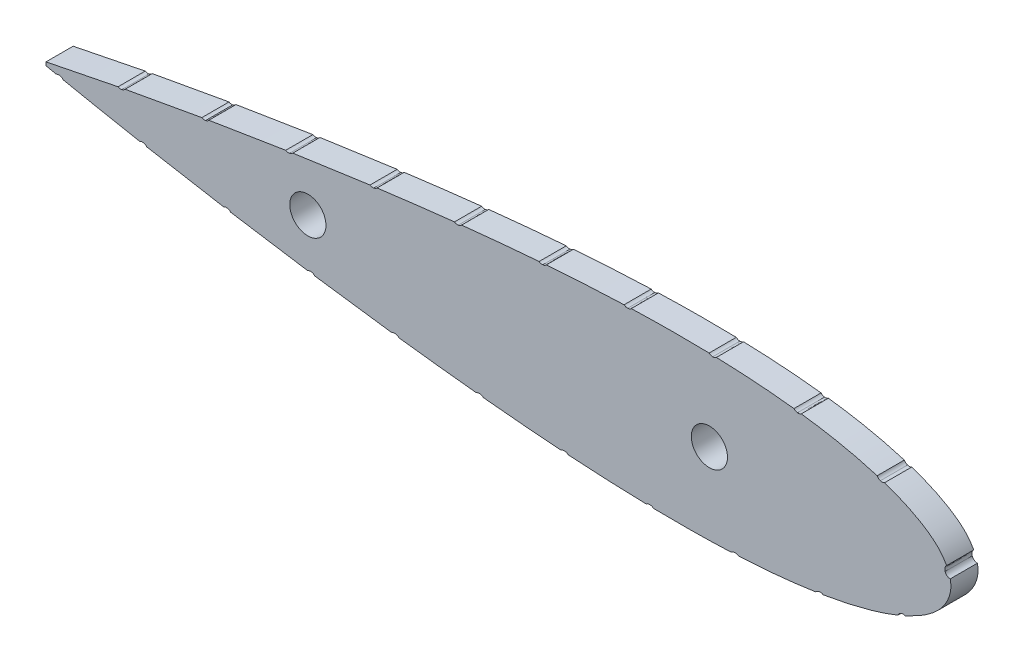
from build123d import *

# Parameters (mm, degrees)
SKETCH1_R           = 2
BOSS_EXTRUDE1_DEPTH = 3
CUT_EXTRUDE1_DEPTH  = 10


with BuildPart() as part:
    # Sketch1 → Boss-Extrude1 (new body)
    with BuildSketch(Plane.XY):
        with BuildLine():
            Line((-220, -0.189), (-220, 0.189))
            add(Edge.make_bspline(
                [(-220, 0.189), (-218.33414458, 0.533383089), (-215.006179921, 1.221374816), (-208.344137236, 2.497831843), (-200.016287914, 3.965674155), (-190.014996408, 5.528168834), (-180.015249764, 6.884288854), (-170.015366318, 7.993417238), (-160.01307518, 8.779505199), (-151.668027673, 9.058728645), (-144.995966244, 8.947287883), (-139.987869065, 8.65073069), (-134.970356471, 8.078172202), (-130.794306968, 7.278076968), (-127.463530799, 6.326486377), (-124.919965675, 5.365093589), (-122.789457128, 4.207381685), (-120.829702633, 2.6061248), (-119.458572693, 0), (-120.829702633, -2.6061248), (-122.789457128, -4.207381685), (-124.919965675, -5.365093589), (-127.463530799, -6.326486377), (-130.794306968, -7.278076968), (-134.970356471, -8.078172202), (-139.987869065, -8.65073069), (-144.995966244, -8.947287883), (-151.668027673, -9.058728645), (-160.01307518, -8.779505199), (-170.015366318, -7.993417238), (-180.015249764, -6.884288854), (-190.014996408, -5.528168834), (-200.016287914, -3.965674155), (-208.344137236, -2.497831843), (-215.006179921, -1.221374816), (-218.33414458, -0.533383089), (-220, -0.189)],
                knots=[0, 0, 0, 0, 0.024603844, 0.049152359, 0.098108667, 0.146905312, 0.195554797, 0.244056277, 0.292409554, 0.340643731, 0.364754111, 0.3889056, 0.413178108, 0.437756239, 0.450304697, 0.463229879, 0.477067953, 0.485035559, 0.5, 0.514964441, 0.522932047, 0.536770121, 0.549695303, 0.562243761, 0.586821892, 0.6110944, 0.635245889, 0.659356269, 0.707590446, 0.755943723, 0.804445203, 0.853094688, 0.901891333, 0.950847641, 0.975396156, 1, 1, 1, 1], degree=3))
        make_face()
        with Locations((-191.062269847, 0)):
            Circle(SKETCH1_R, mode=Mode.SUBTRACT)
        with Locations((-146.687624955, 0)):
            Circle(SKETCH1_R, mode=Mode.SUBTRACT)
    extrude(amount=BOSS_EXTRUDE1_DEPTH)

    # Sketch2 → Cut-Extrude1 (cut)
    with BuildSketch(Plane.XY.offset(3)):
        with BuildLine():
            add(Edge.make_bspline(
                [(-218.697260254, -1.58380119), (-218.656315579, -1.590402434), (-218.576324974, -1.6032988), (-218.454980449, -1.590868554), (-218.338725142, -1.556304977), (-218.230200928, -1.497736774), (-218.133774359, -1.421261847), (-218.057451032, -1.326247784), (-217.997789537, -1.218858789), (-217.977930951, -1.138896852), (-217.967804667, -1.09812269)],
                knots=[0, 0, 0, 0, 1.017083743, 1.987001844, 2.972391076, 3.986042786, 5.004656253, 5.979834707, 6.969878046, 8, 8, 8, 8], degree=3))
            add(Edge.make_bspline(
                [(-217.967804667, -1.09812269), (-217.961337513, -1.057199017), (-217.94863495, -0.976818136), (-217.959324197, -0.855106092), (-217.996291515, -0.73924141), (-218.052895983, -0.629563747), (-218.129452171, -0.532963052), (-218.22070025, -0.452745498), (-218.32790462, -0.394958778), (-218.406432616, -0.374196016), (-218.446459125, -0.363613027)],
                knots=[0, 0, 0, 0, 1.019051807, 2.001586779, 2.979565923, 4.002845271, 5.029175072, 6.001582509, 6.981386527, 8, 8, 8, 8], degree=3))
            add(Edge.make_bspline(
                [(-218.446459125, -0.363613027), (-218.487411383, -0.356887905), (-218.56765309, -0.343710726), (-218.688754566, -0.357984213), (-218.80492213, -0.393329346), (-218.913117999, -0.452823907), (-219.009497267, -0.530568581), (-219.089848208, -0.622802143), (-219.146132381, -0.73174314), (-219.167147706, -0.810105634), (-219.177864726, -0.850067543)],
                knots=[0, 0, 0, 0, 1.017323363, 1.993339767, 2.969660132, 3.993090107, 5.011943554, 6.005958459, 6.983114227, 8, 8, 8, 8], degree=3))
            add(Edge.make_bspline(
                [(-219.177864726, -0.850067543), (-219.183964972, -0.891654787), (-219.195923832, -0.973182005), (-219.186109849, -1.096221565), (-219.150587, -1.213223754), (-219.092376546, -1.321989046), (-219.015412951, -1.417289018), (-218.923484728, -1.496210608), (-218.815600919, -1.552089863), (-218.737227655, -1.573091268), (-218.697260254, -1.58380119)],
                knots=[0, 0, 0, 0, 1.03204317, 2.023207143, 3.008371278, 4.021791435, 5.040172216, 6.006883534, 6.98358598, 8, 8, 8, 8], degree=3))
        make_face()
        with BuildLine():
            add(Edge.make_bspline(
                [(-209.454093155, -3.39072638), (-209.41313478, -3.395905473), (-209.333006792, -3.406037476), (-209.212560341, -3.393248724), (-209.097831618, -3.355930044), (-208.991258447, -3.295520816), (-208.897566743, -3.215851043), (-208.820296862, -3.121799846), (-208.7649076, -3.012136874), (-208.746213474, -2.932576519), (-208.736640585, -2.891835246)],
                knots=[0, 0, 0, 0, 1.017350342, 1.990270291, 2.963727447, 3.97931436, 4.996664702, 5.986102446, 6.968723191, 8, 8, 8, 8], degree=3))
            add(Edge.make_bspline(
                [(-208.736640585, -2.891835246), (-208.730790174, -2.851049542), (-208.719231735, -2.770470753), (-208.73403217, -2.649978783), (-208.769488191, -2.534114214), (-208.829482751, -2.426964705), (-208.907776575, -2.331925336), (-209.001490511, -2.25542917), (-209.108649328, -2.198238516), (-209.187500397, -2.180199792), (-209.227863467, -2.170965951)],
                knots=[0, 0, 0, 0, 1.01599218, 2.007257742, 2.974947525, 4.0003418, 5.02558983, 6.005291499, 6.978928747, 8, 8, 8, 8], degree=3))
            add(Edge.make_bspline(
                [(-209.227863467, -2.170965951), (-209.268656235, -2.16504312), (-209.348812326, -2.153405006), (-209.469066352, -2.169053363), (-209.584766779, -2.205334439), (-209.690517096, -2.268263921), (-209.786456743, -2.345350895), (-209.861167893, -2.441044636), (-209.918809079, -2.548193156), (-209.936943613, -2.627559504), (-209.946170218, -2.667940021)],
                knots=[0, 0, 0, 0, 1.015131532, 1.994691214, 2.969194873, 3.99532649, 5.019706031, 5.994823937, 6.979793698, 8, 8, 8, 8], degree=3))
            add(Edge.make_bspline(
                [(-209.946170218, -2.667940021), (-209.951489579, -2.709342465), (-209.961894325, -2.790326238), (-209.950127083, -2.912599346), (-209.911322496, -3.028361127), (-209.852360779, -3.136309582), (-209.773405721, -3.22992222), (-209.680823097, -3.306828617), (-209.572411165, -3.361226637), (-209.494156264, -3.38073761), (-209.454093155, -3.39072638)],
                knots=[0, 0, 0, 0, 1.029108418, 2.012950774, 3.00360181, 4.02703375, 5.033689393, 6.011516172, 6.981982694, 8, 8, 8, 8], degree=3))
        make_face()
        with BuildLine():
            add(Edge.make_bspline(
                [(-200.1631017, -5.027933636), (-200.121852608, -5.032979576), (-200.040921765, -5.042879726), (-199.920224074, -5.025066035), (-199.805586625, -4.985742665), (-199.698705287, -4.924084928), (-199.605961744, -4.842589253), (-199.53002031, -4.746425881), (-199.477870402, -4.634538003), (-199.459601411, -4.553965723), (-199.450263468, -4.512782313)],
                knots=[0, 0, 0, 0, 1.016013028, 1.993420662, 2.962496889, 3.977929338, 5.000523251, 5.975816916, 6.965366724, 8, 8, 8, 8], degree=3))
            add(Edge.make_bspline(
                [(-199.450263468, -4.512782313), (-199.446049586, -4.471392354), (-199.437771318, -4.390080815), (-199.451875453, -4.267959066), (-199.492751786, -4.15252007), (-199.554944136, -4.045751122), (-199.63371733, -3.950708637), (-199.730367514, -3.876406225), (-199.839527463, -3.822056939), (-199.918943294, -3.804624354), (-199.959279891, -3.795770059)],
                knots=[0, 0, 0, 0, 1.020846881, 2.005477475, 2.993257936, 4.010403059, 5.030380147, 6.007318786, 6.987884685, 8, 8, 8, 8], degree=3))
            add(Edge.make_bspline(
                [(-199.959279891, -3.795770059), (-200.000515693, -3.79086695), (-200.081202544, -3.781272946), (-200.202564063, -3.797032611), (-200.317952732, -3.836782051), (-200.423737192, -3.901585791), (-200.517006403, -3.982363166), (-200.592475202, -4.078344404), (-200.644551636, -4.189132766), (-200.662474291, -4.268791204), (-200.671637421, -4.309517351)],
                knots=[0, 0, 0, 0, 1.017437535, 1.990838647, 2.978338469, 3.996502279, 5.020529926, 5.997191007, 6.976044541, 8, 8, 8, 8], degree=3))
            add(Edge.make_bspline(
                [(-200.671637421, -4.309517351), (-200.676768399, -4.351225738), (-200.686887652, -4.43348253), (-200.670401689, -4.556033478), (-200.631971027, -4.67296524), (-200.568183903, -4.778932537), (-200.488258926, -4.872933813), (-200.392450585, -4.947037307), (-200.283341828, -5.001514503), (-200.20392234, -5.018964534), (-200.1631017, -5.027933636)],
                knots=[0, 0, 0, 0, 1.026868821, 2.025178646, 3.003008525, 4.026719509, 5.037918843, 6.01235648, 6.978375654, 8, 8, 8, 8], degree=3))
        make_face()
        with BuildLine():
            add(Edge.make_bspline(
                [(-190.857676115, -6.4842893), (-190.81647415, -6.487999182), (-190.736159309, -6.49523084), (-190.616051205, -6.478709934), (-190.502851517, -6.436434376), (-190.397362304, -6.372959911), (-190.306035119, -6.289731724), (-190.233575997, -6.191576021), (-190.181619043, -6.079887541), (-190.165847649, -5.999098591), (-190.157753082, -5.957634178)],
                knots=[0, 0, 0, 0, 1.016544963, 1.981547422, 2.95626941, 3.974200754, 4.995989429, 5.978674654, 6.962567667, 8, 8, 8, 8], degree=3))
            add(Edge.make_bspline(
                [(-190.157753082, -5.957634178), (-190.154095664, -5.916430144), (-190.146926374, -5.835661784), (-190.162967886, -5.714733992), (-190.20418351, -5.60011524), (-190.268666637, -5.495021754), (-190.349614594, -5.401882221), (-190.446631905, -5.328348106), (-190.557209981, -5.277323164), (-190.636251582, -5.26076887), (-190.676581488, -5.252322265)],
                knots=[0, 0, 0, 0, 1.018597505, 1.996660093, 2.983144274, 4.003130959, 5.022898425, 6.011721769, 6.985507986, 8, 8, 8, 8], degree=3))
            add(Edge.make_bspline(
                [(-190.676581488, -5.252322265), (-190.717805872, -5.2485246), (-190.798820201, -5.241061412), (-190.91926672, -5.259153408), (-191.03378109, -5.300383355), (-191.137165808, -5.367664575), (-191.230891663, -5.448520489), (-191.302074967, -5.547482415), (-191.3564303, -5.6569353), (-191.3715769, -5.737034587), (-191.379346046, -5.778119921)],
                knots=[0, 0, 0, 0, 1.016415999, 1.997464924, 2.972063253, 3.990885665, 5.018844379, 6.001404936, 6.974860488, 8, 8, 8, 8], degree=3))
            add(Edge.make_bspline(
                [(-191.379346046, -5.778119921), (-191.383531041, -5.820275781), (-191.39166348, -5.902194624), (-191.37347207, -6.024477341), (-191.33072004, -6.138890377), (-191.266943375, -6.244444958), (-191.185237207, -6.335983485), (-191.087705243, -6.407763493), (-190.978288152, -6.461382744), (-190.898246958, -6.476584113), (-190.857676115, -6.4842893)],
                knots=[0, 0, 0, 0, 1.038609022, 2.0182639, 3.008511575, 4.024867508, 5.034649745, 6.004359402, 6.988460601, 8, 8, 8, 8], degree=3))
        make_face()
        with BuildLine():
            add(Edge.make_bspline(
                [(-181.522284908, -7.760086813), (-181.481253745, -7.763109228), (-181.400808511, -7.769034941), (-181.281236894, -7.749797404), (-181.170036965, -7.703649881), (-181.066573435, -7.63932411), (-180.975263105, -7.556525888), (-180.907266458, -7.455746244), (-180.856138551, -7.344101042), (-180.841998974, -7.263333876), (-180.834715508, -7.22172974)],
                knots=[0, 0, 0, 0, 1.01473174, 1.989471543, 2.960522047, 3.972597417, 4.990272548, 5.98076505, 6.959867839, 8, 8, 8, 8], degree=3))
            add(Edge.make_bspline(
                [(-180.834715508, -7.22172974), (-180.831257504, -7.180155682), (-180.824499664, -7.098909146), (-180.847672888, -6.979052489), (-180.888503913, -6.864747943), (-180.956014885, -6.761660391), (-181.039071728, -6.671010657), (-181.136285326, -6.598899865), (-181.247083775, -6.549143504), (-181.326318517, -6.53522008), (-181.366908004, -6.528087544)],
                knots=[0, 0, 0, 0, 1.026745248, 2.006527595, 2.990423172, 4.011471134, 5.029217693, 6.017133677, 6.984239433, 8, 8, 8, 8], degree=3))
            add(Edge.make_bspline(
                [(-181.366908004, -6.528087544), (-181.407959523, -6.52498049), (-181.489097218, -6.518839447), (-181.609024831, -6.539634391), (-181.721943318, -6.585284003), (-181.824816157, -6.652965561), (-181.915539362, -6.736287554), (-181.985179123, -6.83591455), (-182.034983626, -6.946712195), (-182.049127023, -7.026918035), (-182.056285116, -7.067510888)],
                knots=[0, 0, 0, 0, 1.013588785, 2.003342613, 2.973299363, 4.002084792, 5.028910282, 5.99539945, 6.985454756, 8, 8, 8, 8], degree=3))
            add(Edge.make_bspline(
                [(-182.056285116, -7.067510888), (-182.059622662, -7.109501504), (-182.066128504, -7.191353373), (-182.046969707, -7.312702344), (-182.001933685, -7.425779694), (-181.935434736, -7.5288665), (-181.853098684, -7.620238832), (-181.753089056, -7.688606828), (-181.642688738, -7.739038126), (-181.562907275, -7.752985315), (-181.522284908, -7.760086813)],
                knots=[0, 0, 0, 0, 1.036292566, 2.020034298, 2.998768905, 4.017456004, 5.032849332, 6.0096806, 6.986588072, 8, 8, 8, 8], degree=3))
        make_face()
        with BuildLine():
            add(Edge.make_bspline(
                [(-172.157549354, -8.830223401), (-172.116590222, -8.83239739), (-172.036287009, -8.836659648), (-171.918641876, -8.810819903), (-171.80702286, -8.766776726), (-171.706212051, -8.697820989), (-171.619134731, -8.612004989), (-171.550098509, -8.511767146), (-171.503211046, -8.398276712), (-171.490998075, -8.317137475), (-171.484795161, -8.275927218)],
                knots=[0, 0, 0, 0, 1.012308337, 1.984700588, 2.95724742, 3.971632593, 4.988386099, 5.972075339, 6.970026087, 8, 8, 8, 8], degree=3))
            add(Edge.make_bspline(
                [(-171.484795161, -8.275927218), (-171.482584276, -8.234514412), (-171.478250243, -8.153332239), (-171.502862798, -8.034028721), (-171.549818974, -7.922438062), (-171.617533751, -7.819987454), (-171.70263586, -7.731784425), (-171.801639586, -7.663029674), (-171.913063086, -7.616170784), (-171.992793754, -7.604312555), (-172.033536919, -7.598252882)],
                knots=[0, 0, 0, 0, 1.024593132, 2.008526036, 2.988169627, 4.011440798, 5.035299718, 6.007932833, 6.982033842, 8, 8, 8, 8], degree=3))
            add(Edge.make_bspline(
                [(-172.033536919, -7.598252882), (-172.074925602, -7.596143953), (-172.155413054, -7.592042775), (-172.274705342, -7.614900516), (-172.385461345, -7.663429254), (-172.486586902, -7.733051829), (-172.573915183, -7.819115694), (-172.643121241, -7.918671718), (-172.687756833, -8.031897164), (-172.700043393, -8.111878524), (-172.706291111, -8.152549065)],
                knots=[0, 0, 0, 0, 1.023907344, 1.991164857, 2.977108749, 3.999841887, 5.016166536, 5.999440866, 6.982715195, 8, 8, 8, 8], degree=3))
            add(Edge.make_bspline(
                [(-172.706291111, -8.152549065), (-172.708530795, -8.194430805), (-172.712886206, -8.275876323), (-172.689941819, -8.396121839), (-172.64405487, -8.50819474), (-172.575208581, -8.609770597), (-172.489462261, -8.696305281), (-172.390576594, -8.765548663), (-172.278442951, -8.812092506), (-172.198271514, -8.824116136), (-172.157549354, -8.830223401)],
                knots=[0, 0, 0, 0, 1.034811226, 2.012350397, 3.000411703, 4.013265455, 5.028483964, 5.999408191, 6.98382238, 8, 8, 8, 8], degree=3))
        make_face()
        with BuildLine():
            add(Edge.make_bspline(
                [(-162.74339823, -9.638940642), (-162.702147052, -9.640011209), (-162.620942812, -9.642118654), (-162.503317074, -9.611627451), (-162.391668029, -9.564201702), (-162.293561758, -9.489646231), (-162.207394958, -9.401262042), (-162.1430533, -9.297101263), (-162.100591355, -9.181433322), (-162.090754969, -9.099762911), (-162.085711765, -9.057889758)],
                knots=[0, 0, 0, 0, 1.010205218, 1.988620704, 2.961116924, 3.976511524, 4.996343518, 5.982220741, 6.965466448, 8, 8, 8, 8], degree=3))
            add(Edge.make_bspline(
                [(-162.085711765, -9.057889758), (-162.084940846, -9.016725227), (-162.08341786, -8.935402799), (-162.109730734, -8.816406143), (-162.161950778, -8.70672191), (-162.232922438, -8.606331554), (-162.320934387, -8.519480816), (-162.424409899, -8.45545291), (-162.537438126, -8.410968816), (-162.617862034, -8.401578856), (-162.658807365, -8.396798249)],
                knots=[0, 0, 0, 0, 1.014489628, 2.004170991, 2.976962093, 3.997102291, 5.028450758, 6.007362029, 6.985510372, 8, 8, 8, 8], degree=3))
            add(Edge.make_bspline(
                [(-162.658807365, -8.396798249), (-162.699989135, -8.39595431), (-162.780880549, -8.3942966), (-162.899856746, -8.421544156), (-163.009824715, -8.473753648), (-163.109133892, -8.54717329), (-163.194193677, -8.63623241), (-163.261320915, -8.738263736), (-163.302620208, -8.853263172), (-163.312536553, -8.933862553), (-163.31756178, -8.974707258)],
                knots=[0, 0, 0, 0, 1.012949068, 1.98968824, 2.977866715, 3.99601926, 5.018621251, 6.001134601, 6.987050932, 8, 8, 8, 8], degree=3))
            add(Edge.make_bspline(
                [(-163.31756178, -8.974707258), (-163.318630357, -9.016887732), (-163.320717148, -9.099260653), (-163.29303308, -9.219607648), (-163.24364418, -9.331618331), (-163.169221632, -9.430519492), (-163.081149615, -9.515743454), (-162.978615326, -9.580842767), (-162.865157239, -9.624504434), (-162.784313006, -9.634089631), (-162.74339823, -9.638940642)],
                knots=[0, 0, 0, 0, 1.03372899, 2.018736836, 3.007491397, 4.02237714, 5.041698052, 6.00491788, 6.990301039, 8, 8, 8, 8], degree=3))
        make_face()
        with BuildLine():
            add(Edge.make_bspline(
                [(-153.300987328, -10.062931805), (-153.259582584, -10.061308345), (-153.178705049, -10.058137175), (-153.061248247, -10.026967368), (-152.955029871, -9.969692454), (-152.858668398, -9.894887845), (-152.77877158, -9.801798561), (-152.72005014, -9.695638411), (-152.682198876, -9.578517701), (-152.676241249, -9.49637469), (-152.673182863, -9.45420605)],
                knots=[0, 0, 0, 0, 1.02085579, 1.994078245, 2.967989923, 3.981221809, 4.990102983, 5.973082298, 6.95946883, 8, 8, 8, 8], degree=3))
            add(Edge.make_bspline(
                [(-152.673182863, -9.45420605), (-152.67477994, -9.412786288), (-152.677899574, -9.331879419), (-152.709554654, -9.214216735), (-152.765740098, -9.106860307), (-152.842096367, -9.010446428), (-152.93324838, -8.928019071), (-153.038335243, -8.867189305), (-153.153911415, -8.8298414), (-153.23455752, -8.82380666), (-153.275722583, -8.820726282)],
                knots=[0, 0, 0, 0, 1.022854299, 1.997982012, 2.984404427, 3.999619897, 5.025761833, 6.005331366, 6.981839737, 8, 8, 8, 8], degree=3))
            add(Edge.make_bspline(
                [(-153.275722583, -8.820726282), (-153.317114428, -8.822377441), (-153.397966767, -8.825602714), (-153.515850829, -8.856445255), (-153.621841306, -8.915584032), (-153.718253309, -8.992197498), (-153.798868865, -9.085318095), (-153.858620397, -9.191238291), (-153.895766255, -9.307118145), (-153.901898162, -9.388229385), (-153.905009716, -9.429388196)],
                knots=[0, 0, 0, 0, 1.021360064, 1.995063264, 2.975640288, 3.997365632, 5.023900495, 5.996453334, 6.983327114, 8, 8, 8, 8], degree=3))
            add(Edge.make_bspline(
                [(-153.905009716, -9.429388196), (-153.903356474, -9.47127772), (-153.900108315, -9.553578967), (-153.869463279, -9.673016917), (-153.812589614, -9.781548646), (-153.735633193, -9.8772406), (-153.642985392, -9.957216982), (-153.538039973, -10.016272099), (-153.422829324, -10.053886825), (-153.342162809, -10.05987513), (-153.300987328, -10.062931805)],
                knots=[0, 0, 0, 0, 1.032082427, 2.027754513, 3.011393867, 4.031727098, 5.039731339, 6.010959063, 6.984712343, 8, 8, 8, 8], degree=3))
        make_face()
        with BuildLine():
            add(Edge.make_bspline(
                [(-143.82322469, -9.956485438), (-143.782172976, -9.952449137), (-143.701340696, -9.944501517), (-143.58711677, -9.902275263), (-143.483561803, -9.839581631), (-143.393504327, -9.756340826), (-143.319508356, -9.658338397), (-143.267567352, -9.547911013), (-143.236359079, -9.428685098), (-143.236995884, -9.346101472), (-143.237320261, -9.304034885)],
                knots=[0, 0, 0, 0, 1.012445362, 1.993540801, 2.968945603, 3.977792258, 4.995721205, 5.973633967, 6.967806246, 8, 8, 8, 8], degree=3))
            add(Edge.make_bspline(
                [(-143.237320261, -9.304034885), (-143.24152005, -9.263043742), (-143.249777325, -9.182450368), (-143.289570525, -9.067461824), (-143.353300168, -8.9641374), (-143.435923692, -8.872590844), (-143.534041015, -8.798037703), (-143.642569465, -8.742921083), (-143.760777898, -8.714510777), (-143.841633582, -8.714493538), (-143.882658987, -8.71448479)],
                knots=[0, 0, 0, 0, 1.016100133, 1.997771509, 2.976697371, 3.9989593, 5.02879904, 6.006119793, 6.988324127, 8, 8, 8, 8], degree=3))
            add(Edge.make_bspline(
                [(-143.882658987, -8.71448479), (-143.923639469, -8.718707857), (-144.00421188, -8.7270109), (-144.119562582, -8.76654174), (-144.222373571, -8.831683758), (-144.311816662, -8.9160451), (-144.386372523, -9.014045244), (-144.437484689, -9.12376983), (-144.469929233, -9.241162847), (-144.46920871, -9.32237622), (-144.468839601, -9.363980139)],
                knots=[0, 0, 0, 0, 1.015645235, 1.996877125, 2.980769731, 4.00023209, 5.021378242, 6.002381735, 6.976661761, 8, 8, 8, 8], degree=3))
            add(Edge.make_bspline(
                [(-144.468839601, -9.363980139), (-144.464565518, -9.405953087), (-144.456210295, -9.488004213), (-144.416516024, -9.604590247), (-144.352434523, -9.708348647), (-144.270243054, -9.799157319), (-144.172936385, -9.874361061), (-144.063406335, -9.925081643), (-143.946049549, -9.957587975), (-143.864831173, -9.956858919), (-143.82322469, -9.956485438)],
                knots=[0, 0, 0, 0, 1.036926318, 2.027043013, 3.002580043, 4.021303119, 5.030360116, 6.008405446, 6.979747583, 8, 8, 8, 8], degree=3))
        make_face()
        with BuildLine():
            add(Edge.make_bspline(
                [(-134.344897434, -9.015032627), (-134.304541357, -9.006401491), (-134.225473684, -8.989490929), (-134.116455546, -8.935452679), (-134.02024229, -8.861898052), (-133.940014819, -8.768397447), (-133.879056176, -8.66178487), (-133.836759323, -8.54701134), (-133.823105795, -8.424449787), (-133.831178008, -8.342558446), (-133.835292105, -8.300821582)],
                knots=[0, 0, 0, 0, 1.012785711, 1.984301159, 2.96667441, 3.977700793, 4.995308973, 5.977077965, 6.968994516, 8, 8, 8, 8], degree=3))
            add(Edge.make_bspline(
                [(-133.835292105, -8.300821582), (-133.844224237, -8.260072975), (-133.861608901, -8.180763719), (-133.913362749, -8.070131019), (-133.98809648, -7.974583322), (-134.079770072, -7.892421982), (-134.185371695, -7.828634522), (-134.29997031, -7.788392321), (-134.420607614, -7.769933941), (-134.501250397, -7.779403821), (-134.542404508, -7.784236547)],
                knots=[0, 0, 0, 0, 1.026970072, 1.998797982, 2.983113067, 4.000392807, 5.021034499, 6.004744131, 6.981769018, 8, 8, 8, 8], degree=3))
            add(Edge.make_bspline(
                [(-134.542404508, -7.784236547), (-134.583248165, -7.792991182), (-134.662806368, -7.810044085), (-134.772154426, -7.86434528), (-134.86909325, -7.937660891), (-134.947638405, -8.033308682), (-135.010909095, -8.1392105), (-135.052485519, -8.25424583), (-135.067127232, -8.375651713), (-135.059286403, -8.456666497), (-135.05529082, -8.497950563)],
                knots=[0, 0, 0, 0, 1.024336744, 1.995276506, 2.977067637, 3.993854241, 5.019925436, 6.001112666, 6.981393349, 8, 8, 8, 8], degree=3))
            add(Edge.make_bspline(
                [(-135.05529082, -8.497950563), (-135.04619882, -8.539167333), (-135.028497931, -8.619410784), (-134.97658948, -8.731030652), (-134.901640128, -8.827434423), (-134.808870672, -8.908367938), (-134.702882152, -8.970814196), (-134.588626786, -9.012247272), (-134.467189849, -9.026863827), (-134.386179328, -9.019026451), (-134.344897434, -9.015032627)],
                knots=[0, 0, 0, 0, 1.03525736, 2.015505443, 2.996130472, 4.01577697, 5.023464958, 6.003486804, 6.982603178, 8, 8, 8, 8], degree=3))
        make_face()
        with BuildLine():
            add(Edge.make_bspline(
                [(-125.036806645, -6.496534824), (-124.999674074, -6.478810809), (-124.926512373, -6.44388947), (-124.834430737, -6.364965393), (-124.758423393, -6.270552057), (-124.703630259, -6.160539777), (-124.667396436, -6.042721914), (-124.656979648, -5.920754603), (-124.67161612, -5.798421471), (-124.700469271, -5.721096406), (-124.715129872, -5.681806695)],
                knots=[0, 0, 0, 0, 1.009307495, 1.988622192, 2.955817418, 3.97674459, 4.995635143, 5.973509504, 6.970318039, 8, 8, 8, 8], degree=3))
            add(Edge.make_bspline(
                [(-124.715129872, -5.681806695), (-124.733220964, -5.644339038), (-124.768451003, -5.571375667), (-124.847309607, -5.478633391), (-124.941834651, -5.403086384), (-125.051498229, -5.346007005), (-125.169341169, -5.309572183), (-125.290399198, -5.298031755), (-125.411547311, -5.310057148), (-125.487853471, -5.338325731), (-125.526790266, -5.352750359)],
                knots=[0, 0, 0, 0, 1.023302985, 1.992748982, 2.974342655, 3.99407058, 5.026148727, 5.99858839, 6.978738374, 8, 8, 8, 8], degree=3))
            add(Edge.make_bspline(
                [(-125.526790266, -5.352750359), (-125.564234994, -5.370863055), (-125.637598223, -5.406350183), (-125.730607875, -5.485097218), (-125.805053925, -5.581089179), (-125.859140484, -5.691942842), (-125.893436006, -5.811009681), (-125.90572902, -5.932229857), (-125.891705472, -6.053552683), (-125.863799541, -6.129589732), (-125.849504893, -6.168539258)],
                knots=[0, 0, 0, 0, 1.021645264, 2.001648785, 2.970828259, 3.99617528, 5.021522301, 6.009528449, 6.980392787, 8, 8, 8, 8], degree=3))
            add(Edge.make_bspline(
                [(-125.849504893, -6.168539258), (-125.830924331, -6.206251503), (-125.794480346, -6.280220443), (-125.716246883, -6.375396379), (-125.620641817, -6.451741601), (-125.510812952, -6.507148292), (-125.393311426, -6.541399322), (-125.273033573, -6.554163943), (-125.152201885, -6.538490541), (-125.075771388, -6.510701732), (-125.036806645, -6.496534824)],
                knots=[0, 0, 0, 0, 1.032249434, 2.02465795, 3.003678304, 4.024298625, 5.032126422, 6.002016762, 6.981415686, 8, 8, 8, 8], degree=3))
        make_face()
        with BuildLine():
            add(Edge.make_bspline(
                [(-119.469869042, 1.483092257), (-119.485036072, 1.521468607), (-119.514615119, 1.596310935), (-119.584155237, 1.69555665), (-119.672798439, 1.777052806), (-119.776886783, 1.841232707), (-119.891102066, 1.883849458), (-120.01021116, 1.907733969), (-120.132839969, 1.901351368), (-120.211892151, 1.879650969), (-120.252111389, 1.868610496)],
                knots=[0, 0, 0, 0, 1.018920366, 1.987118975, 2.969695084, 3.981747491, 4.994318462, 5.973836912, 6.969152617, 8, 8, 8, 8], degree=3))
            add(Edge.make_bspline(
                [(-120.252111389, 1.868610496), (-120.290478047, 1.853432149), (-120.365762291, 1.823648726), (-120.46547766, 1.7538272), (-120.547124188, 1.664298261), (-120.6131049, 1.561169785), (-120.659637779, 1.447536805), (-120.67838019, 1.328305161), (-120.676345907, 1.207239688), (-120.653858669, 1.129732786), (-120.642391894, 1.090210185)],
                knots=[0, 0, 0, 0, 1.02064517, 2.002741578, 2.986980967, 4.007847287, 5.026130532, 6.006693373, 6.983565827, 8, 8, 8, 8], degree=3))
            add(Edge.make_bspline(
                [(-120.642391894, 1.090210185), (-120.62722575, 1.051830672), (-120.597648432, 0.976982176), (-120.528095785, 0.877781171), (-120.439500836, 0.796112815), (-120.334866003, 0.732378101), (-120.220925125, 0.687239571), (-120.101113645, 0.667683292), (-119.979657431, 0.671264296), (-119.901753969, 0.693632592), (-119.86222822, 0.704981557)],
                knots=[0, 0, 0, 0, 1.021016783, 1.991207449, 2.975805197, 3.98993989, 5.015004983, 5.995924843, 6.983195747, 8, 8, 8, 8], degree=3))
            add(Edge.make_bspline(
                [(-119.86222822, 0.704981557), (-119.823104407, 0.719936954), (-119.746408802, 0.749254477), (-119.646111402, 0.820192727), (-119.563685439, 0.909328204), (-119.500208735, 1.013446631), (-119.455633621, 1.126620465), (-119.432620595, 1.244599178), (-119.438144985, 1.365582697), (-119.459113427, 1.44325222), (-119.469869042, 1.483092257)],
                knots=[0, 0, 0, 0, 1.03439643, 2.027758887, 3.011015355, 4.023768531, 5.030572158, 6.010768851, 6.979637863, 8, 8, 8, 8], degree=3))
        make_face()
        with BuildLine():
            add(Edge.make_bspline(
                [(-127.412668991, 7.381218584), (-127.452376848, 7.391892544), (-127.529972224, 7.412751134), (-127.650722112, 7.414911754), (-127.768937682, 7.393652067), (-127.881181026, 7.346228567), (-127.983785995, 7.28151329), (-128.071605179, 7.198276287), (-128.140010815, 7.097055275), (-128.169150443, 7.020475416), (-128.183995106, 6.981463175)],
                knots=[0, 0, 0, 0, 1.018022228, 1.989375033, 2.971469884, 3.980854552, 4.996204022, 5.969885283, 6.965794323, 8, 8, 8, 8], degree=3))
            add(Edge.make_bspline(
                [(-128.183995106, 6.981463175), (-128.194680118, 6.94176039), (-128.215739793, 6.863507999), (-128.217502763, 6.741948142), (-128.195322932, 6.622859948), (-128.151005489, 6.508734013), (-128.086975519, 6.404536933), (-128.003754928, 6.318010445), (-127.905238244, 6.248332699), (-127.82973471, 6.220280437), (-127.79101177, 6.20589348)],
                knots=[0, 0, 0, 0, 1.018303366, 2.007029841, 2.989395908, 4.012139572, 5.032295411, 6.006245564, 6.977477893, 8, 8, 8, 8], degree=3))
            add(Edge.make_bspline(
                [(-127.79101177, 6.20589348), (-127.751314841, 6.195121122), (-127.673466067, 6.173995687), (-127.552598928, 6.173340595), (-127.434244965, 6.196274993), (-127.320766027, 6.24276906), (-127.217624034, 6.309027337), (-127.130202761, 6.392292652), (-127.060266229, 6.491320162), (-127.032013202, 6.567262963), (-127.017612027, 6.605972643)],
                knots=[0, 0, 0, 0, 1.017720609, 1.995829429, 2.969222208, 3.995211102, 5.021714553, 5.995107332, 6.978063065, 8, 8, 8, 8], degree=3))
            add(Edge.make_bspline(
                [(-127.017612027, 6.605972643), (-127.007204274, 6.646374218), (-126.986747508, 6.725784791), (-126.98282431, 6.84804593), (-127.006847532, 6.966734411), (-127.051722793, 7.079760859), (-127.117145957, 7.182512199), (-127.20022494, 7.269450859), (-127.29876265, 7.339275182), (-127.374358488, 7.367111619), (-127.412668991, 7.381218584)],
                knots=[0, 0, 0, 0, 1.03357593, 2.031526132, 3.0046145, 4.019865641, 5.034596846, 6.007685214, 6.990333545, 8, 8, 8, 8], degree=3))
        make_face()
        with BuildLine():
            add(Edge.make_bspline(
                [(-136.804062994, 9.360797669), (-136.845103895, 9.363747187), (-136.925568221, 9.369529979), (-137.045045855, 9.349969711), (-137.156706718, 9.303817557), (-137.259463761, 9.237651452), (-137.350632371, 9.155052348), (-137.418846164, 9.054940421), (-137.469360908, 8.943498713), (-137.483372695, 8.862721616), (-137.490590335, 8.821112364)],
                knots=[0, 0, 0, 0, 1.015057213, 1.990109661, 2.961471627, 3.982775405, 5.000776953, 5.980117386, 6.959534219, 8, 8, 8, 8], degree=3))
            add(Edge.make_bspline(
                [(-137.490590335, 8.821112364), (-137.493478983, 8.780078793), (-137.499174354, 8.699175428), (-137.480193889, 8.578742022), (-137.434288565, 8.465790352), (-137.369232334, 8.361199881), (-137.285225933, 8.271361693), (-137.188627803, 8.198500104), (-137.077313602, 8.149575128), (-136.997630261, 8.135610631), (-136.957057855, 8.128500321)],
                knots=[0, 0, 0, 0, 1.014737758, 2.000696011, 2.981635858, 4.011006495, 5.028687661, 6.005196104, 6.984304699, 8, 8, 8, 8], degree=3))
            add(Edge.make_bspline(
                [(-136.957057855, 8.128500321), (-136.915980156, 8.125368892), (-136.835242342, 8.119214099), (-136.715694073, 8.141555051), (-136.602856835, 8.185956362), (-136.499349496, 8.25286286), (-136.408760716, 8.336603503), (-136.3397436, 8.437205276), (-136.289748896, 8.548387291), (-136.275789722, 8.628639214), (-136.268724867, 8.669255389)],
                knots=[0, 0, 0, 0, 1.01343626, 1.991899069, 2.971580767, 3.991253616, 5.017924588, 5.995701104, 6.985607425, 8, 8, 8, 8], degree=3))
            add(Edge.make_bspline(
                [(-136.268724867, 8.669255389), (-136.265274493, 8.711292837), (-136.258532378, 8.793435027), (-136.280709183, 8.91408869), (-136.323343233, 9.02785872), (-136.390625818, 9.130322614), (-136.472938774, 9.221603298), (-136.573131753, 9.289760401), (-136.683615914, 9.339982735), (-136.763426035, 9.353775036), (-136.804062994, 9.360797669)],
                knots=[0, 0, 0, 0, 1.036576694, 2.025495963, 2.997397683, 4.016364082, 5.032035808, 6.0091349, 6.986310218, 8, 8, 8, 8], degree=3))
        make_face()
        with BuildLine():
            add(Edge.make_bspline(
                [(-146.286467738, 10.046736269), (-146.327923899, 10.045795896), (-146.409054013, 10.043955579), (-146.526821243, 10.012207685), (-146.633747546, 9.955488572), (-146.729875239, 9.879392377), (-146.810599265, 9.786728746), (-146.870974975, 9.681108907), (-146.910770645, 9.564552866), (-146.916595838, 9.482383916), (-146.919585135, 9.440217521)],
                knots=[0, 0, 0, 0, 1.018615324, 1.993440191, 2.971382072, 3.981214804, 4.997495525, 5.978317501, 6.962539218, 8, 8, 8, 8], degree=3))
            add(Edge.make_bspline(
                [(-146.919585135, 9.440217521), (-146.918641099, 9.398763118), (-146.916793611, 9.317636446), (-146.885097779, 9.199844227), (-146.828004183, 9.092683485), (-146.752417378, 8.996013361), (-146.661582776, 8.912632965), (-146.555879655, 8.853306593), (-146.44108395, 8.813186457), (-146.360352441, 8.807414883), (-146.31915982, 8.804469983)],
                knots=[0, 0, 0, 0, 1.022319469, 2.000689238, 2.982187357, 4.00487245, 5.022794195, 6.007182883, 6.983180658, 8, 8, 8, 8], degree=3))
            add(Edge.make_bspline(
                [(-146.31915982, 8.804469983), (-146.277674157, 8.805320171), (-146.19695739, 8.806974343), (-146.07963043, 8.839814562), (-145.972057564, 8.895167416), (-145.875909747, 8.971956138), (-145.794709878, 9.064035615), (-145.736481041, 9.170628695), (-145.696533198, 9.285724495), (-145.690666543, 9.366922126), (-145.687690753, 9.408108644)],
                knots=[0, 0, 0, 0, 1.02255038, 1.989529737, 2.98178438, 3.99551824, 5.015724998, 5.994927084, 6.982950989, 8, 8, 8, 8], degree=3))
            add(Edge.make_bspline(
                [(-145.687690753, 9.408108644), (-145.688656954, 9.450045673), (-145.690558692, 9.532588812), (-145.721561588, 9.65171958), (-145.777390626, 9.76033161), (-145.852740456, 9.856709055), (-145.944548562, 9.938448006), (-146.049686792, 9.997971799), (-146.164559575, 10.038000944), (-146.245280512, 10.043784999), (-146.286467738, 10.046736269)],
                knots=[0, 0, 0, 0, 1.031673327, 2.030605342, 3.003284778, 4.023213567, 5.030818252, 6.012553851, 6.985921152, 8, 8, 8, 8], degree=3))
        make_face()
        with BuildLine():
            add(Edge.make_bspline(
                [(-155.75664322, 9.996649292), (-155.797742286, 9.993057218), (-155.878163279, 9.986028394), (-155.993168384, 9.946986562), (-156.097504283, 9.885826749), (-156.187483075, 9.802582193), (-156.265267997, 9.70736321), (-156.317163311, 9.596705051), (-156.350415597, 9.478215202), (-156.350829942, 9.39581733), (-156.351041264, 9.353793245)],
                knots=[0, 0, 0, 0, 1.014251473, 1.984646377, 2.966549096, 3.974325305, 4.993406225, 5.976823058, 6.968151053, 8, 8, 8, 8], degree=3))
            add(Edge.make_bspline(
                [(-156.351041264, 9.353793245), (-156.347389594, 9.312717225), (-156.340201631, 9.231863), (-156.301692302, 9.116099174), (-156.239607996, 9.011405088), (-156.15741902, 8.919815914), (-156.061274627, 8.843149664), (-155.953506577, 8.788156247), (-155.836025346, 8.757508886), (-155.755317095, 8.755555305), (-155.713805564, 8.754550499)],
                knots=[0, 0, 0, 0, 1.016863676, 2.001599074, 2.986030681, 4.006051529, 5.027757091, 6.009298003, 6.97610115, 8, 8, 8, 8], degree=3))
            add(Edge.make_bspline(
                [(-155.713805564, 8.754550499), (-155.67270966, 8.758144784), (-155.592294851, 8.765177937), (-155.477244724, 8.804188261), (-155.37247905, 8.865823702), (-155.281418188, 8.949278132), (-155.206419091, 9.04694694), (-155.153192047, 9.155761342), (-155.120085279, 9.272989804), (-155.119569734, 9.354404881), (-155.11930681, 9.395925925)],
                knots=[0, 0, 0, 0, 1.016294537, 1.988644163, 2.972524783, 3.999493594, 5.021650853, 5.996455524, 6.978208175, 8, 8, 8, 8], degree=3))
            add(Edge.make_bspline(
                [(-155.11930681, 9.395925925), (-155.122915825, 9.438023737), (-155.129937877, 9.519933369), (-155.169195087, 9.636121571), (-155.229132837, 9.741860889), (-155.311874946, 9.832661823), (-155.407526128, 9.910614335), (-155.51738509, 9.961803587), (-155.634065652, 9.996180033), (-155.715084528, 9.996490194), (-155.75664322, 9.996649292)],
                knots=[0, 0, 0, 0, 1.037929242, 2.019496917, 2.995371215, 4.012110832, 5.030529745, 6.013307738, 6.980924725, 8, 8, 8, 8], degree=3))
        make_face()
        with BuildLine():
            add(Edge.make_bspline(
                [(-165.195229933, 9.461022139), (-165.236124995, 9.455977188), (-165.31683241, 9.446020853), (-165.429959802, 9.401385816), (-165.533059291, 9.336808428), (-165.619608849, 9.249335587), (-165.691407621, 9.149067337), (-165.742133003, 9.037738221), (-165.766366193, 8.916629847), (-165.764173959, 8.834284996), (-165.763050366, 8.792080526)],
                knots=[0, 0, 0, 0, 1.009295571, 1.991869749, 2.961035781, 3.980171259, 4.994872374, 5.979701028, 6.964529682, 8, 8, 8, 8], degree=3))
            add(Edge.make_bspline(
                [(-165.763050366, 8.792080526), (-165.757959702, 8.75121714), (-165.747913152, 8.670572237), (-165.703864568, 8.556797884), (-165.636549021, 8.455197023), (-165.551371874, 8.365926147), (-165.451710691, 8.292875174), (-165.340125957, 8.244636602), (-165.222032734, 8.215179956), (-165.140606321, 8.217683199), (-165.099294929, 8.218953209)],
                knots=[0, 0, 0, 0, 1.012724528, 1.998636881, 2.976057674, 4.001562717, 5.028228327, 5.999538271, 6.985073097, 8, 8, 8, 8], degree=3))
            add(Edge.make_bspline(
                [(-165.099294929, 8.218953209), (-165.058362276, 8.223878064), (-164.977474023, 8.233610218), (-164.86461121, 8.280139813), (-164.762330866, 8.346305783), (-164.674927519, 8.433601749), (-164.603801749, 8.53476294), (-164.55554171, 8.646657641), (-164.52812426, 8.765429822), (-164.530345193, 8.846614115), (-164.531474497, 8.887894823)],
                knots=[0, 0, 0, 0, 1.011985069, 1.999814267, 2.97652138, 3.998372577, 5.024578273, 6.005461476, 6.985814164, 8, 8, 8, 8], degree=3))
            add(Edge.make_bspline(
                [(-164.531474497, 8.887894823), (-164.53669708, 8.929734771), (-164.546944441, 9.011829989), (-164.591028098, 9.127176605), (-164.658302811, 9.228915292), (-164.743589477, 9.317304686), (-164.843994603, 9.387906269), (-164.953824463, 9.439504076), (-165.07311309, 9.463736789), (-165.15400725, 9.461938517), (-165.195229933, 9.461022139)],
                knots=[0, 0, 0, 0, 1.035097089, 2.03099015, 3.006500686, 4.020029379, 5.036187962, 6.01223034, 6.987056655, 8, 8, 8, 8], degree=3))
        make_face()
        with BuildLine():
            add(Edge.make_bspline(
                [(-174.582092086, 8.57488649), (-174.622683091, 8.568139933), (-174.702026621, 8.554952389), (-174.813770273, 8.509066913), (-174.911149534, 8.438418588), (-174.995724625, 8.350435783), (-175.064506596, 8.248867782), (-175.10948157, 8.136287956), (-175.132424584, 8.016208254), (-175.127933488, 7.934473199), (-175.125626788, 7.892492733)],
                knots=[0, 0, 0, 0, 1.017268995, 1.988463059, 2.960430058, 3.976738913, 4.999456156, 5.97842883, 6.961687878, 8, 8, 8, 8], degree=3))
            add(Edge.make_bspline(
                [(-175.125626788, 7.892492733), (-175.11885402, 7.851908739), (-175.105534916, 7.77209758), (-175.059503561, 7.65941058), (-174.98857999, 7.560579634), (-174.900809866, 7.475023376), (-174.799560103, 7.405211973), (-174.687996411, 7.359148764), (-174.569192124, 7.335516556), (-174.488989384, 7.34069807), (-174.4480815, 7.343340932)],
                knots=[0, 0, 0, 0, 1.017992469, 2.001950804, 2.985909139, 4.013167641, 5.028126731, 6.014756485, 6.98741474, 8, 8, 8, 8], degree=3))
            add(Edge.make_bspline(
                [(-174.4480815, 7.343340932), (-174.407497419, 7.350112153), (-174.327686088, 7.363428217), (-174.21500034, 7.409481792), (-174.116502072, 7.480078428), (-174.03094501, 7.568039789), (-173.965113708, 7.671523022), (-173.919487017, 7.783602549), (-173.896435187, 7.903239486), (-173.901806681, 7.984355588), (-173.904546798, 8.025734688)],
                knots=[0, 0, 0, 0, 1.016152564, 1.998332507, 2.98051245, 3.995705927, 5.017154053, 5.995052325, 6.977232268, 8, 8, 8, 8], degree=3))
            add(Edge.make_bspline(
                [(-173.904546798, 8.025734688), (-173.910590702, 8.067041859), (-173.922489352, 8.148363403), (-173.972180198, 8.260128733), (-174.038227865, 8.361806507), (-174.127150166, 8.4458268), (-174.229490362, 8.512650958), (-174.34038395, 8.560046032), (-174.460088051, 8.580839739), (-174.540628635, 8.57690972), (-174.582092086, 8.57488649)],
                knots=[0, 0, 0, 0, 1.028323473, 2.024463382, 2.997172165, 4.012080714, 5.024625228, 6.009195351, 6.975105133, 8, 8, 8, 8], degree=3))
        make_face()
        with BuildLine():
            add(Edge.make_bspline(
                [(-183.94828177, 7.448756438), (-183.988820577, 7.44123133), (-184.06843793, 7.426452177), (-184.178043602, 7.37531965), (-184.276500781, 7.305521642), (-184.357251882, 7.213904529), (-184.423641048, 7.110924784), (-184.469170092, 6.997925979), (-184.486317946, 6.875888674), (-184.48022533, 6.793964132), (-184.477095879, 6.751883876)],
                knots=[0, 0, 0, 0, 1.014662429, 1.992775358, 2.959376161, 3.976022436, 4.98766492, 5.974815305, 6.959770926, 8, 8, 8, 8], degree=3))
            add(Edge.make_bspline(
                [(-184.477095879, 6.751883876), (-184.469546096, 6.711352075), (-184.454628773, 6.631266861), (-184.403269793, 6.520742245), (-184.333174414, 6.420790116), (-184.241077799, 6.338850261), (-184.138879131, 6.270716029), (-184.025925295, 6.227157625), (-183.906490613, 6.206522542), (-183.825835923, 6.213618982), (-183.784800516, 6.217229502)],
                knots=[0, 0, 0, 0, 1.015552805, 2.00659135, 2.985486217, 4.013331463, 5.034902629, 6.005822659, 6.985404604, 8, 8, 8, 8], degree=3))
            add(Edge.make_bspline(
                [(-183.784800516, 6.217229502), (-183.744352012, 6.224937531), (-183.664988124, 6.240061431), (-183.553567605, 6.288786358), (-183.455753162, 6.361286164), (-183.372648297, 6.452343668), (-183.306763887, 6.556387561), (-183.265369468, 6.670554987), (-183.244956148, 6.790522419), (-183.252024835, 6.871631724), (-183.255601228, 6.91266888)],
                knots=[0, 0, 0, 0, 1.015101615, 1.991727823, 2.97452924, 4.001917835, 5.022303415, 5.995558766, 6.985855368, 8, 8, 8, 8], degree=3))
            add(Edge.make_bspline(
                [(-183.255601228, 6.91266888), (-183.262751813, 6.954323234), (-183.2767131, 7.035652024), (-183.3287858, 7.147120894), (-183.39863435, 7.246179028), (-183.489121064, 7.329149946), (-183.593507921, 7.393631112), (-183.706065772, 7.439469269), (-183.826613464, 7.457132314), (-183.90715007, 7.451588022), (-183.94828177, 7.448756438)],
                knots=[0, 0, 0, 0, 1.037617373, 2.025914634, 3.002101807, 4.01028392, 5.028299325, 6.013583018, 6.985496012, 8, 8, 8, 8], degree=3))
        make_face()
        with BuildLine():
            add(Edge.make_bspline(
                [(-193.284528834, 6.120127636), (-193.324947066, 6.111915819), (-193.404136517, 6.095826812), (-193.514002244, 6.043868041), (-193.608959991, 5.969059632), (-193.689841172, 5.877390815), (-193.754029479, 5.772363061), (-193.795261118, 5.657678448), (-193.81250131, 5.535299744), (-193.803644563, 5.453446496), (-193.799086835, 5.411324391)],
                knots=[0, 0, 0, 0, 1.013783302, 1.986255689, 2.962313592, 3.974335833, 4.984814628, 5.977258975, 6.959087027, 8, 8, 8, 8], degree=3))
            add(Edge.make_bspline(
                [(-193.799086835, 5.411324391), (-193.790795573, 5.370391795), (-193.774645258, 5.290660352), (-193.721748888, 5.18055633), (-193.648936079, 5.083161859), (-193.556323835, 5.001638681), (-193.452168245, 4.935620997), (-193.337513105, 4.896213088), (-193.217601531, 4.875893224), (-193.136826221, 4.884500683), (-193.095604479, 4.888893293)],
                knots=[0, 0, 0, 0, 1.026913519, 2.000295733, 2.984556614, 4.007983644, 5.02856913, 6.004854006, 6.98182509, 8, 8, 8, 8], degree=3))
            add(Edge.make_bspline(
                [(-193.095604479, 4.888893293), (-193.055099608, 4.896947654), (-192.975188568, 4.912837899), (-192.866272977, 4.967430758), (-192.768694565, 5.04035644), (-192.687969251, 5.133689949), (-192.62455872, 5.240195815), (-192.582814691, 5.355026132), (-192.565951544, 5.476474403), (-192.574077546, 5.55739957), (-192.578212486, 5.598578583)],
                knots=[0, 0, 0, 0, 1.012415334, 1.997368709, 2.967918079, 3.995304979, 5.012541018, 6.003646191, 6.984149394, 8, 8, 8, 8], degree=3))
            add(Edge.make_bspline(
                [(-192.578212486, 5.598578583), (-192.586661437, 5.639975954), (-192.60312331, 5.720634281), (-192.656108136, 5.831803683), (-192.728921938, 5.929233187), (-192.821467124, 6.010519686), (-192.927367214, 6.072800105), (-193.041242844, 6.115919064), (-193.162457905, 6.132300312), (-193.243361035, 6.124232809), (-193.284528834, 6.120127636)],
                knots=[0, 0, 0, 0, 1.0357378, 2.01802373, 2.999103845, 4.008799376, 5.02506804, 6.005544692, 6.985115453, 8, 8, 8, 8], degree=3))
        make_face()
        with BuildLine():
            add(Edge.make_bspline(
                [(-202.573619441, 4.61168365), (-202.614109481, 4.603140493), (-202.69330834, 4.586430005), (-202.800551225, 4.53065387), (-202.896132001, 4.458032099), (-202.973095584, 4.3635332), (-203.034842383, 4.258220452), (-203.07559219, 4.143394829), (-203.088307803, 4.021468408), (-203.079389829, 3.940240437), (-203.074850318, 3.898893016)],
                knots=[0, 0, 0, 0, 1.020812133, 1.996717154, 2.965594238, 3.976574649, 4.99348027, 5.979185932, 6.971346343, 8, 8, 8, 8], degree=3))
            add(Edge.make_bspline(
                [(-203.074850318, 3.898893016), (-203.066313452, 3.858400287), (-203.049615268, 3.779196168), (-202.993531009, 3.671570746), (-202.920343844, 3.574850598), (-202.826296485, 3.495882125), (-202.721152222, 3.432494492), (-202.607251262, 3.392975416), (-202.487019472, 3.378213669), (-202.407087561, 3.386997287), (-202.366181963, 3.391492352)],
                knots=[0, 0, 0, 0, 1.021960932, 1.998964215, 2.980578929, 4.013892483, 5.024000756, 6.010815709, 6.982023911, 8, 8, 8, 8], degree=3))
            add(Edge.make_bspline(
                [(-202.366181963, 3.391492352), (-202.325925326, 3.400675263), (-202.247146898, 3.418645351), (-202.139196219, 3.473448345), (-202.045027011, 3.548768008), (-201.965843042, 3.6423753), (-201.905077309, 3.749181676), (-201.866756656, 3.864203065), (-201.850089145, 3.984543431), (-201.860279399, 4.064939902), (-201.865443578, 4.105682925)],
                knots=[0, 0, 0, 0, 1.020699688, 1.997412692, 2.971040194, 3.993433502, 5.019205661, 5.998149572, 6.985509724, 8, 8, 8, 8], degree=3))
            add(Edge.make_bspline(
                [(-201.865443578, 4.105682925), (-201.874353226, 4.146525773), (-201.891772284, 4.226376739), (-201.945203921, 4.336698679), (-202.021114276, 4.431305506), (-202.113447015, 4.511653833), (-202.219207276, 4.573247097), (-202.333394845, 4.611277721), (-202.453159587, 4.626786868), (-202.532882969, 4.616791176), (-202.573619441, 4.61168365)],
                knots=[0, 0, 0, 0, 1.033245763, 2.020076352, 3.00469662, 4.020341452, 5.037464661, 6.015808036, 6.986132067, 8, 8, 8, 8], degree=3))
        make_face()
        with BuildLine():
            add(Edge.make_bspline(
                [(-211.853877961, 2.939848325), (-211.894072573, 2.930095419), (-211.972542985, 2.911055191), (-212.080339834, 2.855202104), (-212.172391633, 2.777654751), (-212.249813162, 2.68331266), (-212.309545147, 2.576087803), (-212.346192294, 2.459756604), (-212.359274427, 2.337434413), (-212.347798519, 2.256286168), (-212.341947596, 2.21491322)],
                knots=[0, 0, 0, 0, 1.019271675, 1.989885307, 2.967860311, 3.97466855, 4.990415864, 5.981217068, 6.970735584, 8, 8, 8, 8], degree=3))
            add(Edge.make_bspline(
                [(-212.341947596, 2.21491322), (-212.332194934, 2.174711035), (-212.313038811, 2.095746131), (-212.256855643, 1.987808583), (-212.180025503, 1.89370626), (-212.085653039, 1.814486861), (-211.978755109, 1.753773864), (-211.863753431, 1.71676648), (-211.743481657, 1.703182727), (-211.663204792, 1.714310153), (-211.622285201, 1.719982145)],
                knots=[0, 0, 0, 0, 1.02054594, 2.004550516, 2.97999305, 4.009526251, 5.035999478, 6.001331128, 6.981216916, 8, 8, 8, 8], degree=3))
            add(Edge.make_bspline(
                [(-211.622285201, 1.719982145), (-211.581967759, 1.729528877), (-211.503205827, 1.748178846), (-211.396823978, 1.807150588), (-211.30149614, 1.882171364), (-211.224374239, 1.978829255), (-211.16498123, 2.086984303), (-211.130274226, 2.203379457), (-211.115887063, 2.324222868), (-211.127112696, 2.404527369), (-211.132834747, 2.445461046)],
                knots=[0, 0, 0, 0, 1.018833808, 1.990337552, 2.975801823, 3.998803256, 5.021950612, 6.00468422, 6.982926091, 8, 8, 8, 8], degree=3))
            add(Edge.make_bspline(
                [(-211.132834747, 2.445461046), (-211.142776786, 2.48611959), (-211.162309041, 2.565997879), (-211.218701024, 2.674926814), (-211.29545219, 2.769195138), (-211.389712482, 2.847449825), (-211.49717, 2.906588099), (-211.61194837, 2.94486784), (-211.73296337, 2.956143219), (-211.81297769, 2.945360196), (-211.853877961, 2.939848325)],
                knots=[0, 0, 0, 0, 1.030695332, 2.024917067, 2.998438589, 4.015215306, 5.030229589, 6.010851907, 6.983223283, 8, 8, 8, 8], degree=3))
        make_face()
        with BuildLine():
            add(Edge.make_bspline(
                [(-221.075208556, 1.106016223), (-221.115495067, 1.096559696), (-221.194295822, 1.07806265), (-221.300250087, 1.01987582), (-221.394164314, 0.94511136), (-221.468971426, 0.848896336), (-221.528321125, 0.742214306), (-221.566464096, 0.626496615), (-221.576419479, 0.504313845), (-221.565667073, 0.423308293), (-221.560193782, 0.382074091)],
                knots=[0, 0, 0, 0, 1.020812133, 1.996717154, 2.965594238, 3.976574649, 4.99348027, 5.979185932, 6.971346343, 8, 8, 8, 8], degree=3))
            add(Edge.make_bspline(
                [(-221.560193782, 0.382074091), (-221.550743484, 0.341784749), (-221.53225862, 0.262978457), (-221.473755094, 0.156648721), (-221.398399621, 0.061608197), (-221.302590688, -0.015213502), (-221.196039998, -0.076207425), (-221.081274561, -0.113140888), (-220.960739722, -0.125180201), (-220.881026862, -0.114591423), (-220.840233364, -0.109172557)],
                knots=[0, 0, 0, 0, 1.021960932, 1.998964215, 2.980578929, 4.013892483, 5.024000756, 6.010815709, 6.982023911, 8, 8, 8, 8], degree=3))
            add(Edge.make_bspline(
                [(-220.840233364, -0.109172557), (-220.800194663, -0.099081717), (-220.721842713, -0.0793349), (-220.615158831, -0.022104956), (-220.522716815, 0.055324786), (-220.445669723, 0.150698639), (-220.387334614, 0.258851731), (-220.351624602, 0.374710211), (-220.337682468, 0.495396691), (-220.349688028, 0.575542186), (-220.35577216, 0.61615802)],
                knots=[0, 0, 0, 0, 1.020699688, 1.997412692, 2.971040194, 3.993433502, 5.019205661, 5.998149572, 6.985509724, 8, 8, 8, 8], degree=3))
            add(Edge.make_bspline(
                [(-220.35577216, 0.61615802), (-220.365603061, 0.656788963), (-220.384823241, 0.736225636), (-220.440735798, 0.845311182), (-220.518765976, 0.938177348), (-220.612891931, 1.01641732), (-220.720017887, 1.075603404), (-220.835036202, 1.111042315), (-220.955121013, 1.123839396), (-221.03459799, 1.112043569), (-221.075208556, 1.106016223)],
                knots=[0, 0, 0, 0, 1.033245763, 2.020076352, 3.00469662, 4.020341452, 5.037464661, 6.015808036, 6.986132067, 8, 8, 8, 8], degree=3))
        make_face()
    extrude(amount=-CUT_EXTRUDE1_DEPTH, mode=Mode.SUBTRACT)


solid = part.part
